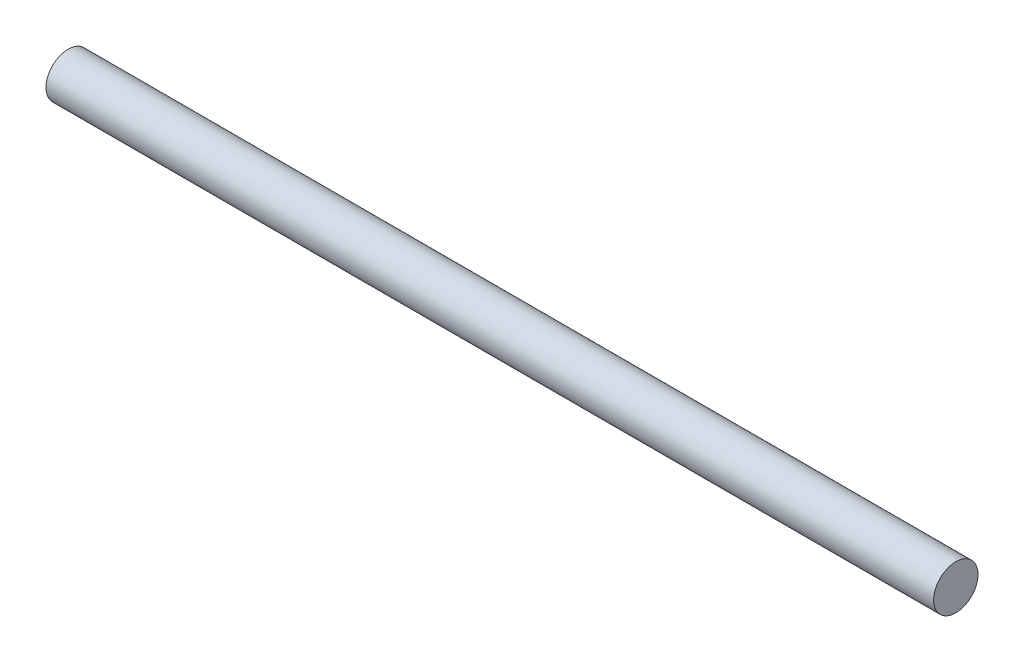
from build123d import *

# Parameters (mm, degrees)
SKETCH1_R           = 2.54
BOSS_EXTRUDE1_DEPTH = 101.6


with BuildPart() as part:
    # Sketch1 → Boss-Extrude1 (new body)
    with BuildSketch(Plane(origin=(0, 0, 0), x_dir=(0, 0, -1), z_dir=(1, 0, 0))):
        Circle(SKETCH1_R)
    extrude(amount=BOSS_EXTRUDE1_DEPTH)


solid = part.part
